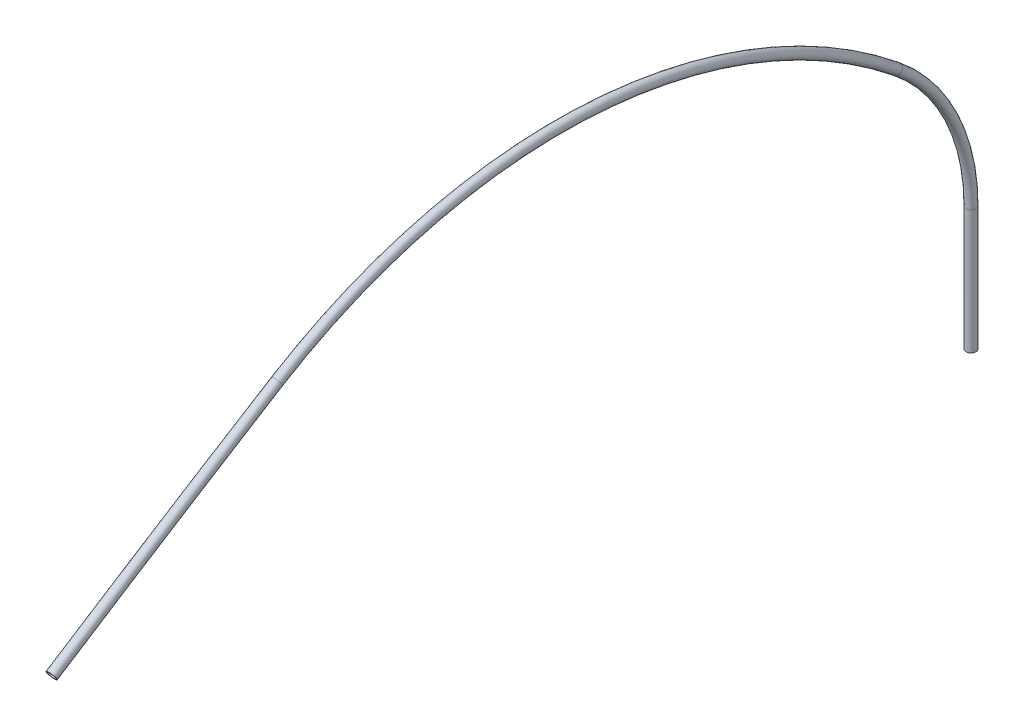
from build123d import *

# Parameters (mm, degrees)
CROQUIS7_R = 5
VACIADO2_T = -1


with BuildPart() as part:
    # Barrer1: sweep along a path in Croquis5
    with BuildLine(Plane(origin=(0, 0, 0), x_dir=(0, 0, -1), z_dir=(1, 0, 0))) as barrer1_path:
        Line((-12, 40), (-12, 165.365990192))
        ThreePointArc((-12, 165.365990192), (-31.81169347, 252.685181838), (-87.367011893, 322.904488462))
        ThreePointArc((-87.367011893, 322.904488462), (-394.310300944, 442.200020465), (-713.815994308, 362.439638334))
        ThreePointArc((-713.815994308, 362.439638334), (-828.134675977, 291.184581817), (-941.723901996, 218.772346732))
    # Croquis7 → Barrer1 (sweep)
    with BuildSketch(Plane(origin=(0, 40, 12), x_dir=(-1, 0, 0), z_dir=(0, 1, 0))):
        Circle(CROQUIS7_R)
    sweep(path=barrer1_path.line)

    # Vaciado2
    vaciado2_openings = [part.faces().sort_by_distance(p)[0] for p in [
        (0, 218.772346732, 941.723901996),
        (0, 40, 12),
    ]]
    offset(amount=VACIADO2_T, openings=vaciado2_openings, kind=Kind.INTERSECTION)


solid = part.part
